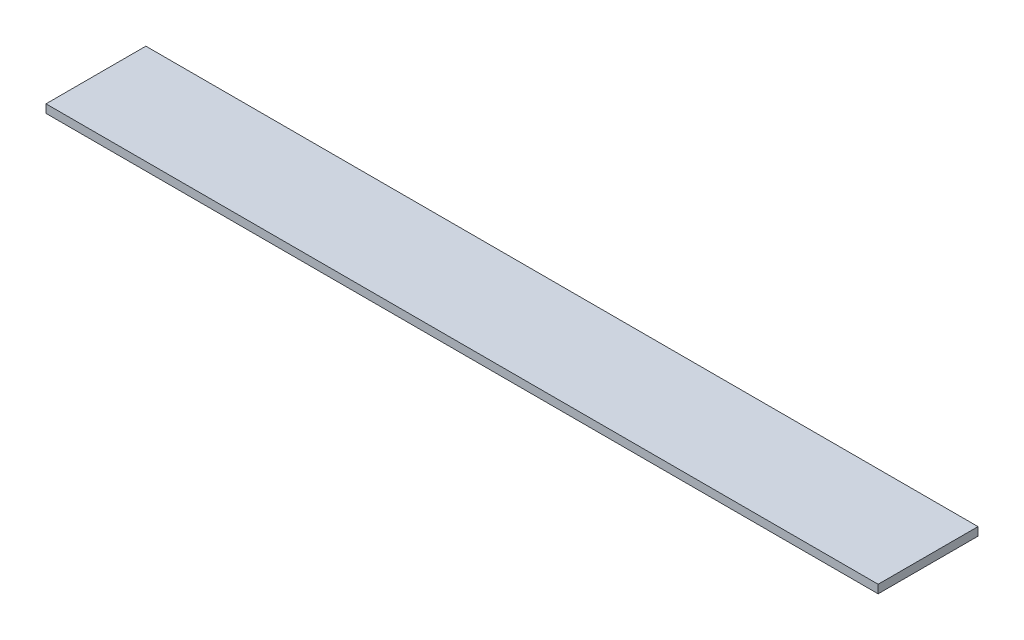
from build123d import *

# Parameters (mm, degrees)
CROQUIS1_W              = 50
CROQUIS1_H              = 6
SALIENTE_EXTRUIR1_DEPTH = 0.5


with BuildPart() as part:
    # Croquis1 → Saliente-Extruir1 (new body)
    with BuildSketch(Plane(origin=(0, 0, 0), x_dir=(1, 0, 0), z_dir=(0, 1, 0))):
        with Locations((25, 3)):
            Rectangle(CROQUIS1_W, CROQUIS1_H)
    extrude(amount=SALIENTE_EXTRUIR1_DEPTH)


solid = part.part
